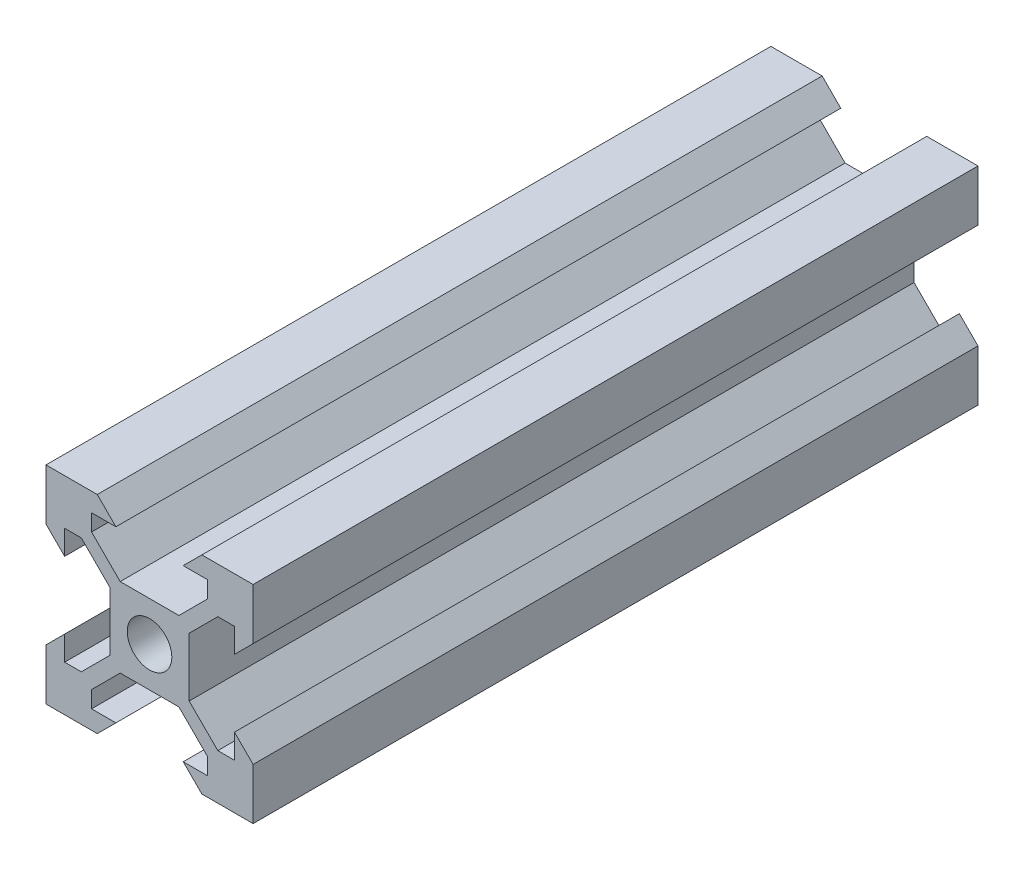
from build123d import *

# Parameters (mm, degrees)
CROQUIS1_R              = 2.15
SALIENTE_EXTRUIR2_DEPTH = 70


with BuildPart() as part:
    # Croquis1 → Saliente-Extruir2 (new body)
    with BuildSketch(Plane.XY):
        Polygon((4.4, 0), (0, 0), (0, -0.56736664), (0, -4.4), (0, -4.95), (1.8, -6.75), (1.8, -4.4), (3.410050506, -4.4), (6.175, -7.164949494), (6.175, -12.835050506), (3.410050506, -15.6), (1.8, -15.6), (1.8, -13.25), (0, -15.05), (0, -15.6), (0, -20), (4.4, -20), (4.95, -20), (6.75, -18.2), (4.4, -18.2), (4.4, -16.589949494), (7.164949494, -13.825), (12.835050506, -13.825), (15.6, -16.589949494), (15.6, -18.2), (13.25, -18.2), (15.05, -20), (15.6, -20), (18.2, -20), (20, -20), (20, -15.6), (20, -15.05), (18.2, -13.25), (18.2, -15.6), (16.589949494, -15.6), (13.825, -12.835050506), (13.825, -7.164949494), (16.589949494, -4.4), (18.2, -4.4), (18.2, -6.75), (20, -4.95), (20, -4.4), (20, 0), (15.6, 0), (15.05, 0), (13.25, -1.8), (15.6, -1.8), (15.6, -3.410050506), (12.835050506, -6.175), (7.164949494, -6.175), (4.4, -3.410050506), (4.4, -1.8), (6.75, -1.8), (4.95, 0), align=None)
        with Locations((10, -10)):
            Circle(CROQUIS1_R, mode=Mode.SUBTRACT)
    extrude(amount=SALIENTE_EXTRUIR2_DEPTH)


solid = part.part
